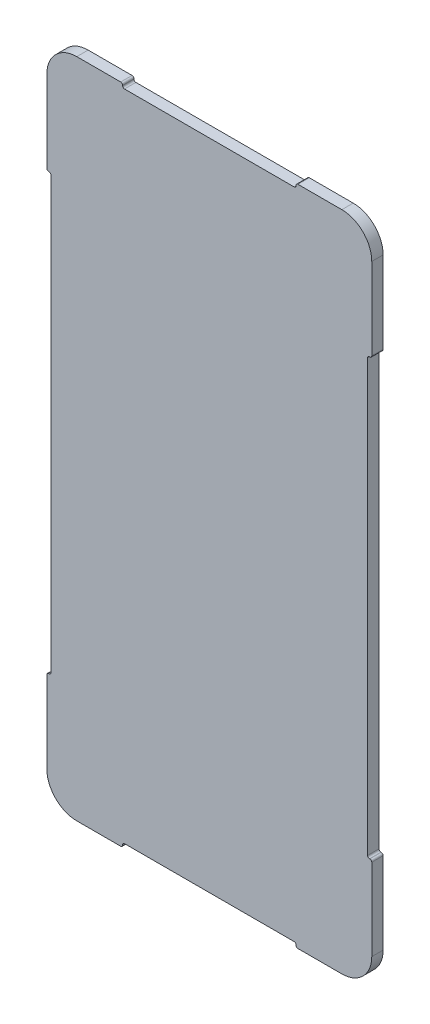
from build123d import *

# Parameters (mm, degrees)
BOSS_EXTRUDE1_DEPTH = 3


with BuildPart() as part:
    # Sketch1 → Boss-Extrude1 (new body)
    with BuildSketch(Plane.XY.offset(3)):
        with BuildLine():
            Line((42.4, 57.4), (42.3, 57.4))
            ThreePointArc((42.3, 57.4), (41.946446609, 57.253553391), (41.8, 56.9))
            Line((41.8, 56.9), (41.8, -56.9))
            ThreePointArc((41.8, -56.9), (41.946446609, -57.253553391), (42.3, -57.4))
            Line((42.3, -57.4), (42.4, -57.4))
            ThreePointArc((42.4, -57.4), (42.753553391, -57.546446609), (42.9, -57.9))
            Line((42.9, -57.9), (42.9, -79.5))
            ThreePointArc((42.9, -79.5), (40.586143571, -85.086143571), (35, -87.4))
            Line((35, -87.4), (23.4, -87.4))
            ThreePointArc((23.4, -87.4), (23.046446609, -87.253553391), (22.9, -86.9))
            Line((22.9, -86.9), (22.9, -86.8))
            ThreePointArc((22.9, -86.8), (22.753553391, -86.446446609), (22.4, -86.3))
            Line((22.4, -86.3), (-22.4, -86.3))
            ThreePointArc((-22.4, -86.3), (-22.753553391, -86.446446609), (-22.9, -86.8))
            Line((-22.9, -86.8), (-22.9, -86.9))
            ThreePointArc((-22.9, -86.9), (-23.046446609, -87.253553391), (-23.4, -87.4))
            Line((-23.4, -87.4), (-35, -87.4))
            ThreePointArc((-35, -87.4), (-40.586143571, -85.086143571), (-42.9, -79.5))
            Line((-42.9, -79.5), (-42.9, -57.9))
            ThreePointArc((-42.9, -57.9), (-42.753553391, -57.546446609), (-42.4, -57.4))
            Line((-42.4, -57.4), (-42.3, -57.4))
            ThreePointArc((-42.3, -57.4), (-41.946446609, -57.253553391), (-41.8, -56.9))
            Line((-41.8, -56.9), (-41.8, 56.9))
            ThreePointArc((-41.8, 56.9), (-41.946446609, 57.253553391), (-42.3, 57.4))
            Line((-42.3, 57.4), (-42.4, 57.4))
            ThreePointArc((-42.4, 57.4), (-42.753553391, 57.546446609), (-42.9, 57.9))
            Line((-42.9, 57.9), (-42.9, 79.5))
            ThreePointArc((-42.9, 79.5), (-40.586143571, 85.086143571), (-35, 87.4))
            Line((-35, 87.4), (-23.4, 87.4))
            ThreePointArc((-23.4, 87.4), (-23.046446609, 87.253553391), (-22.9, 86.9))
            Line((-22.9, 86.9), (-22.9, 86.8))
            ThreePointArc((-22.9, 86.8), (-22.753553391, 86.446446609), (-22.4, 86.3))
            Line((-22.4, 86.3), (22.4, 86.3))
            ThreePointArc((22.4, 86.3), (22.753553391, 86.446446609), (22.9, 86.8))
            Line((22.9, 86.8), (22.9, 86.9))
            ThreePointArc((22.9, 86.9), (23.046446609, 87.253553391), (23.4, 87.4))
            Line((23.4, 87.4), (35, 87.4))
            ThreePointArc((35, 87.4), (40.586143571, 85.086143571), (42.9, 79.5))
            Line((42.9, 79.5), (42.9, 57.9))
            ThreePointArc((42.9, 57.9), (42.753553391, 57.546446609), (42.4, 57.4))
        make_face()
    extrude(amount=-BOSS_EXTRUDE1_DEPTH)


solid = part.part
